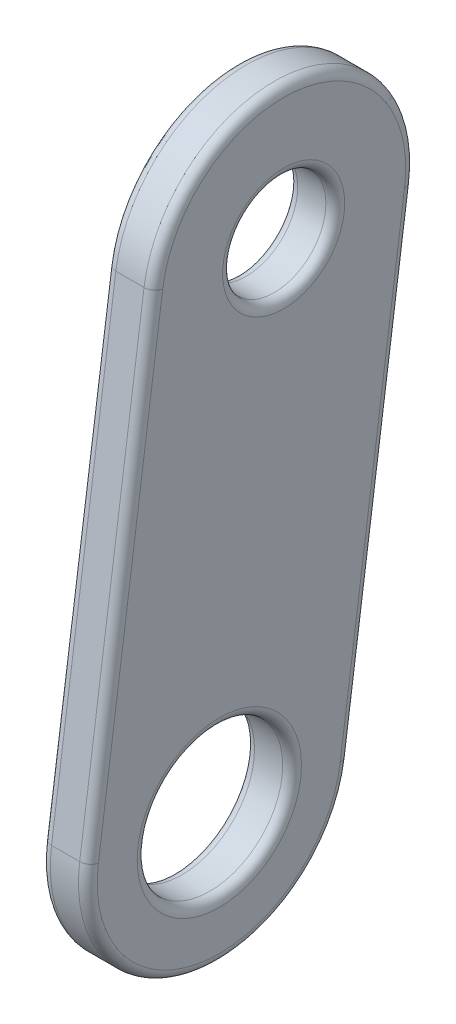
from build123d import *

# Parameters (mm, degrees)
BOSS_EXTRUDE1_DEPTH   = 2.5
M14_CLEARANCE_HOLE1_D = 15.5
M10_CLEARANCE_HOLE1_D = 11
FILLET1_R             = 1


with BuildPart() as part:
    # Sketch1 → Boss-Extrude1 (new, symmetric)
    with BuildSketch(Plane.YZ):
        with BuildLine():
            Line((-47.610552371, 20.717994664), (1.918, 13.867994664))
            ThreePointArc((1.918, 13.867994664), (13.867994664, -1.918), (-1.918, -13.867994664))
            Line((-1.918, -13.867994664), (-51.446552371, -7.017994664))
            ThreePointArc((-51.446552371, -7.017994664), (-63.396547035, 8.768), (-47.610552371, 20.717994664))
        make_face()
    extrude(amount=BOSS_EXTRUDE1_DEPTH, both=True)

    # M14 Clearance Hole1 (through all)
    with Locations(Plane.YZ.offset(2.5)):
        with Locations((-49.528552371, 6.85)):
            Hole(M14_CLEARANCE_HOLE1_D / 2)

    # M10 Clearance Hole1 (through all)
    with Locations(Plane.YZ.offset(2.5)):
        with Locations((0, 0)):
            Hole(M10_CLEARANCE_HOLE1_D / 2)

    # Fillet1
    fillet1_edges = [part.edges().sort_by_distance(p)[0] for p in [
        (2.5, 13.867994664, -1.918),
        (2.5, -22.846276186, 17.292994664),
        (2.5, -41.778552371, 6.85),
        (-2.5, -41.778552371, 6.85),
        (2.5, 5.5, 0),
        (-2.5, 5.5, 0),
        (2.5, -63.396547035, 8.768),
        (-2.5, -22.846276186, 17.292994664),
        (-2.5, 13.867994664, -1.918),
        (-2.5, -26.682276186, -10.442994664),
        (-2.5, -63.396547035, 8.768),
        (2.5, -26.682276186, -10.442994664),
    ]]
    fillet(fillet1_edges, radius=FILLET1_R)


solid = part.part
